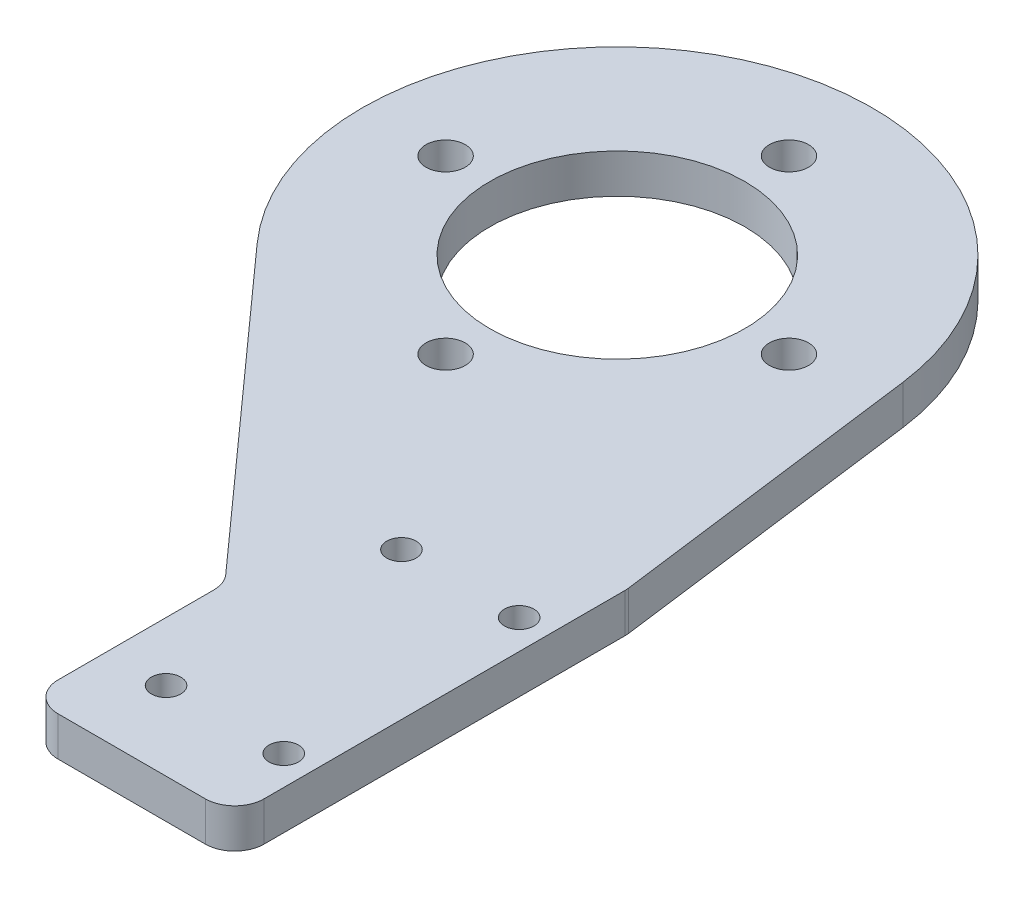
from build123d import *

# Parameters (mm, degrees)
SKETCH_1_R      = 26
SKETCH_1_R_2    = 21
SKETCH_1_W      = 21
SKETCH_1_H      = 40
SKETCH_1_R_3    = 1.5
EXTRUDE_1_DEPTH = 4
EXTRUDE_START   = -4
SKETCH_2_R      = 21
SKETCH_2_R_2    = 13
SKETCH_2_R_3    = 2
EXTRUDE_4_DEPTH = 4
FILLET_1_R      = 3


with BuildPart() as part:
    # 草图1 → 凸台-拉伸1 (new body)
    # profile 1 of 3: a face of its own
    with BuildSketch(Plane(origin=(0, 0, 0), x_dir=(1, 0, 0), z_dir=(0, 1, 0))):
        with Locations((-30, 69)):
            Circle(SKETCH_1_R)
        with Locations(Location((-30, 69, 0), (0, 0, 270))):
            Circle(SKETCH_1_R_2, mode=Mode.SUBTRACT)
    # profile 2 of 3: a face of its own
    with BuildSketch(Plane(origin=(0, 0, 0), x_dir=(1, 0, 0), z_dir=(0, 1, 0))):
        with BuildLine():
            Line((-21, 40), (0, 40))
            Line((0, 40), (-4.218098415, 72.360587846))
            ThreePointArc((-4.218098415, 72.360587846), (-4.054581896, 70.683828791), (-4, 69))
            ThreePointArc((-4, 69), (-20.710760355, 44.716054134), (-49.362309755, 51.647739025))
            Line((-49.362309755, 51.647739025), (-21, 20))
            Line((-21, 20), (-21, 40))
        make_face()
    # profile 3 of 3: a face of its own
    with BuildSketch(Plane(origin=(0, 0, 0), x_dir=(1, 0, 0), z_dir=(0, 1, 0))):
        with Locations((-10.5, 20)):
            Rectangle(SKETCH_1_W, SKETCH_1_H)
        with Locations(Location((-15, 8, 0), (0, 0, 270))):
            Circle(SKETCH_1_R_3, mode=Mode.SUBTRACT)
        with Locations(Location((-3, 8, 0), (0, 0, 270))):
            Circle(SKETCH_1_R_3, mode=Mode.SUBTRACT)
        with Locations(Location((-3, 32, 0), (0, 0, 270))):
            Circle(SKETCH_1_R_3, mode=Mode.SUBTRACT)
        with Locations(Location((-15, 32, 0), (0, 0, 270))):
            Circle(SKETCH_1_R_3, mode=Mode.SUBTRACT)
    extrude(amount=EXTRUDE_1_DEPTH)

    # 草图2 → 凸台-拉伸4 (add)
    with BuildSketch(Plane(origin=(0, 4, 0), x_dir=(1, 0, 0), z_dir=(0, 1, 0)).offset(EXTRUDE_START)):
        with Locations((-30, 69)):
            Circle(SKETCH_2_R)
        with Locations(Location((-30, 69, 0), (0, 0, 270))):
            Circle(SKETCH_2_R_2, mode=Mode.SUBTRACT)
        with Locations(Location((-12.5, 69, 0), (0, 0, 270))):
            Circle(SKETCH_2_R_3, mode=Mode.SUBTRACT)
        with Locations(Location((-30, 51.5, 0), (0, 0, 270))):
            Circle(SKETCH_2_R_3, mode=Mode.SUBTRACT)
        with Locations(Location((-47.5, 69, 0), (0, 0, 270))):
            Circle(SKETCH_2_R_3, mode=Mode.SUBTRACT)
        with Locations(Location((-30, 86.5, 0), (0, 0, 270))):
            Circle(SKETCH_2_R_3, mode=Mode.SUBTRACT)
    extrude(amount=EXTRUDE_4_DEPTH)

    # 圆角1
    fillet_1_edges = [part.edges().sort_by_distance(p)[0] for p in [
        (0, 2, -40),
        (0, 2, 0),
        (-21, 2, 0),
        (-21, 2, -20),
    ]]
    fillet(fillet_1_edges, radius=FILLET_1_R)


solid = part.part
